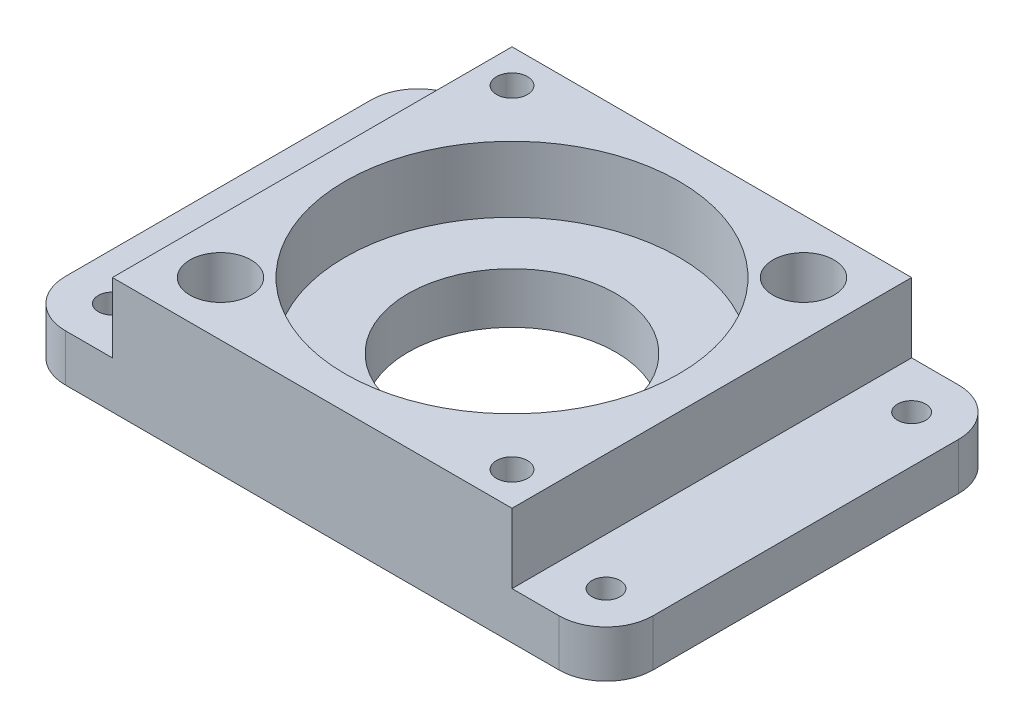
from build123d import *

# Parameters (mm, degrees)
SKETCH_1_W          = 42.5
SKETCH_1_H          = 42.5
EXTRUDE_1_DEPTH     = 12.4
SKETCH_2_R          = 17.75
CUT_EXTRUDE_1_DEPTH = 7
SKETCH_3_R          = 11.05
CUT_EXTRUDE_2_DEPTH = 61.510329697
SKETCH_4_R          = 3.25
CUT_EXTRUDE_3_DEPTH = 10
SKETCH_4_3_R        = 1.65
SKETCH_4_3_R_2      = 1.525
CUT_EXTRUDE_4_DEPTH = 62.36986231
SKETCH_5_W          = 10
SKETCH_5_H          = 42.5
SKETCH_5_R          = 1.5
EXTRUDE_2_DEPTH     = 5
FILLET_1_R          = 5


with BuildPart() as part:
    # 草图1 → 凸台-拉伸1 (new body)
    with BuildSketch(Plane(origin=(0, 0, 0), x_dir=(1, 0, 0), z_dir=(0, 1, 0))):
        with Locations((21.25, 21.25)):
            Rectangle(SKETCH_1_W, SKETCH_1_H)
    extrude(amount=EXTRUDE_1_DEPTH)

    # 草图2 → 切除-拉伸1 (cut)
    with BuildSketch(Plane(origin=(0, 12.4, 0), x_dir=(1, 0, 0), z_dir=(0, 1, 0))):
        with Locations((21.25, 21.25)):
            Circle(SKETCH_2_R)
    extrude(amount=-CUT_EXTRUDE_1_DEPTH, mode=Mode.SUBTRACT)

    # 草图3 → 切除-拉伸2 (cut, through all)
    with BuildSketch(Plane(origin=(0, 5.4, 0), x_dir=(1, 0, 0), z_dir=(0, 1, 0))):
        with Locations((21.25, 21.25)):
            Circle(SKETCH_3_R)
    extrude(amount=-CUT_EXTRUDE_2_DEPTH, mode=Mode.SUBTRACT)

    # 草图4 → 切除-拉伸3 (cut)
    with BuildSketch(Plane(origin=(0, 12.4, 0), x_dir=(1, 0, 0), z_dir=(0, 1, 0))):
        with Locations((36.75, 36.75)):
            Circle(SKETCH_4_R)
        with Locations((5.75, 5.75)):
            Circle(SKETCH_4_R)
    extrude(amount=-CUT_EXTRUDE_3_DEPTH, mode=Mode.SUBTRACT)

    # 草图4<3> → 切除-拉伸4 (cut, through all)
    with BuildSketch(Plane(origin=(0, 12.4, 0), x_dir=(1, 0, 0), z_dir=(0, 1, 0))):
        with Locations((3.57233047, 38.92766953)):
            Circle(SKETCH_4_3_R)
        with Locations((38.92766953, 3.57233047)):
            Circle(SKETCH_4_3_R)
        with Locations((5.75, 5.75)):
            Circle(SKETCH_4_3_R_2)
        with Locations((36.75, 36.75)):
            Circle(SKETCH_4_3_R_2)
    extrude(amount=-CUT_EXTRUDE_4_DEPTH, mode=Mode.SUBTRACT)

    # 草图5 → 凸台-拉伸2 (add)
    # profile 1 of 2: a face of its own
    with BuildSketch(Plane.XZ):
        with Locations((-5, -21.25)):
            Rectangle(SKETCH_5_W, SKETCH_5_H)
        with Locations((-5, -5)):
            Circle(SKETCH_5_R, mode=Mode.SUBTRACT)
        with Locations((-5, -37.5)):
            Circle(SKETCH_5_R, mode=Mode.SUBTRACT)
    # profile 2 of 2: a face of its own
    with BuildSketch(Plane.XZ):
        with Locations((47.5, -21.25)):
            Rectangle(SKETCH_5_W, SKETCH_5_H)
        with Locations((47.5, -37.5)):
            Circle(SKETCH_5_R, mode=Mode.SUBTRACT)
        with Locations((47.5, -5)):
            Circle(SKETCH_5_R, mode=Mode.SUBTRACT)
    extrude(amount=-EXTRUDE_2_DEPTH)

    # 圆角1
    fillet_1_edges = [part.edges().sort_by_distance(p)[0] for p in [
        (-10, 2.5, 0),
        (52.5, 2.5, 0),
        (52.5, 2.5, -42.5),
        (-10, 2.5, -42.5),
    ]]
    fillet(fillet_1_edges, radius=FILLET_1_R)


solid = part.part
